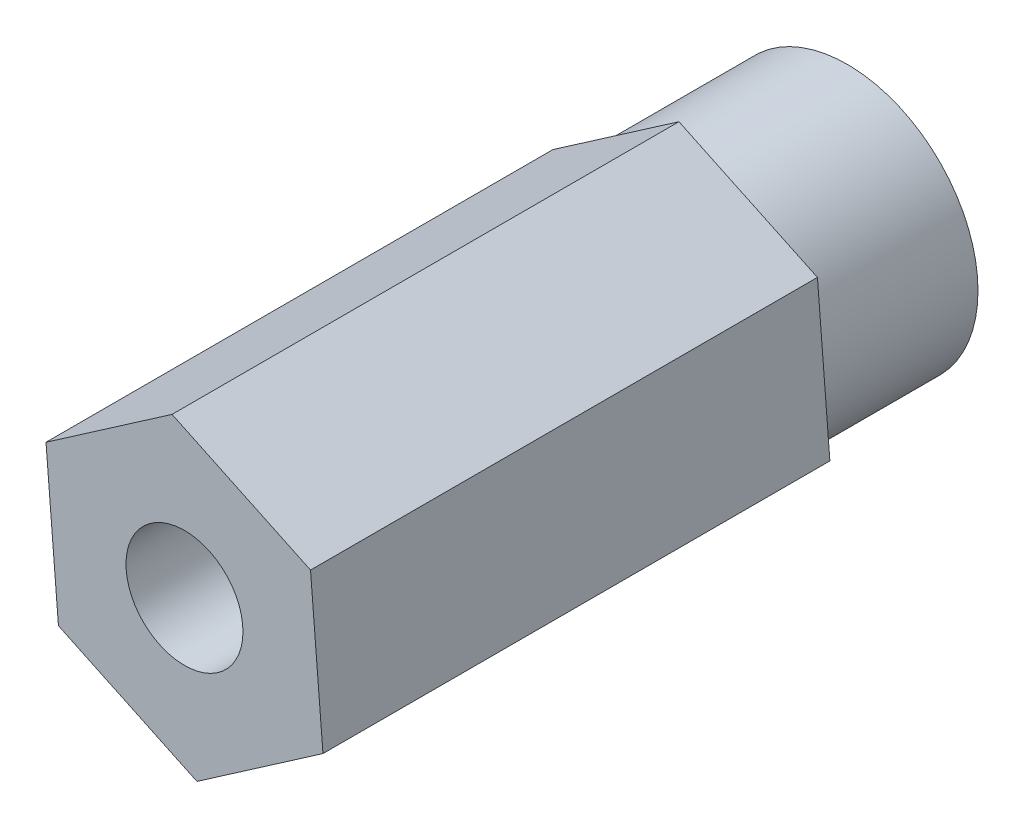
from build123d import *

# Parameters (mm, degrees)
SKETCH_1_R      = 3.35
SKETCH_1_R_2    = 1.5
EXTRUDE_1_DEPTH = 4
SKETCH_3_R      = 1.5
EXTRUDE_2_DEPTH = 13


with BuildPart() as part:
    # 草图1 → 凸台-拉伸1 (new body)
    with BuildSketch(Plane.XY):
        Circle(SKETCH_1_R)
        Circle(SKETCH_1_R_2, mode=Mode.SUBTRACT)
    extrude(amount=EXTRUDE_1_DEPTH)

    # 草图3 → 凸台-拉伸2 (add)
    with BuildSketch(Plane.XY.offset(4)):
        Polygon((3.551375818, -1.681818945), (3.23218584, 2.234672205), (-0.319189978, 3.916491149), (-3.551375818, 1.681818945), (-3.23218584, -2.234672205), (0.319189978, -3.916491149), align=None)
        Circle(SKETCH_3_R, mode=Mode.SUBTRACT)
    extrude(amount=EXTRUDE_2_DEPTH)


solid = part.part
